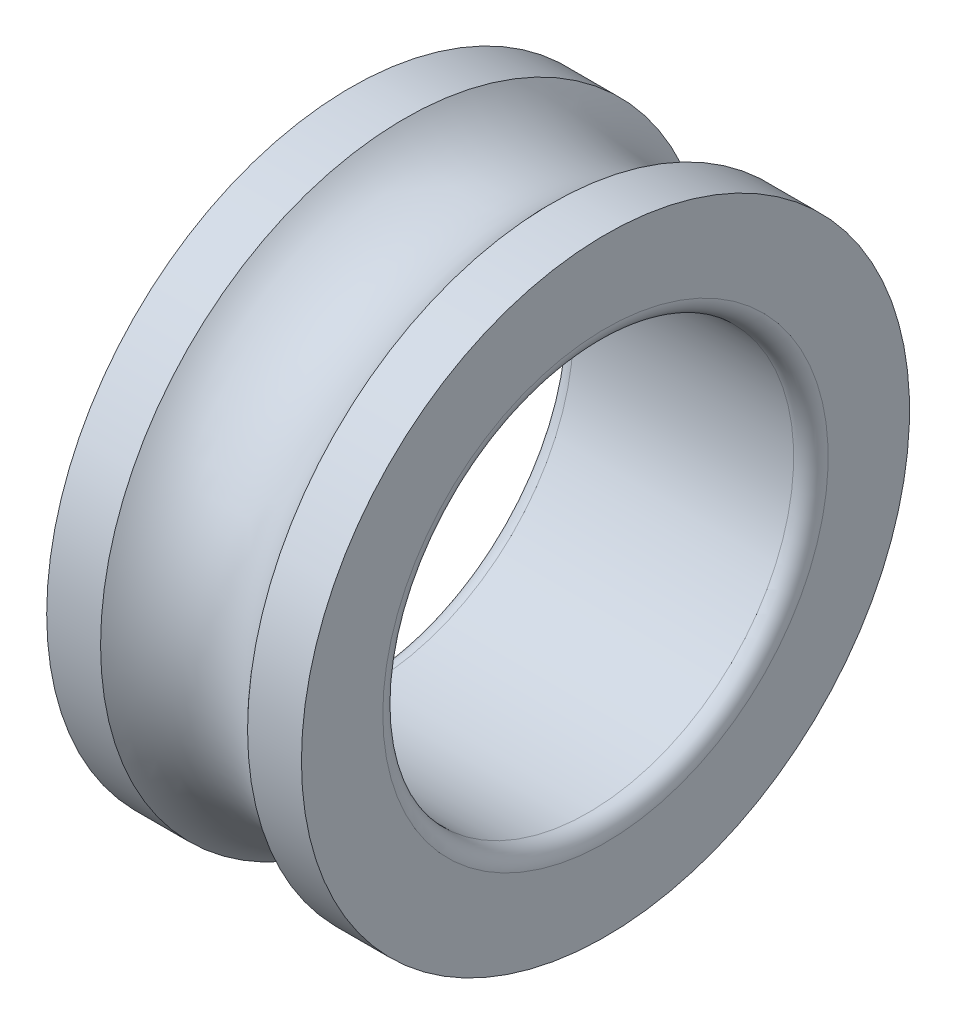
from build123d import *

# Parameters (mm, degrees)
SCALE1_SCALE = 0.168


with BuildPart() as part:
    # Sketch1 → Revolve1 (revolve)
    with BuildSketch(Plane.XY, mode=Mode.PRIVATE) as revolve1_sk:
        with BuildLine():
            Line((-19.243896498, 37), (-12.688168408, 37))
            ThreePointArc((-12.688168408, 37), (-3.743896498, 33), (5.200375412, 37))
            Line((5.200375412, 37), (11.756103502, 37))
            Line((11.756103502, 37), (11.756103502, 27.1))
            ThreePointArc((11.756103502, 27.1), (11.141027743, 25.61507576), (9.656103502, 25))
            Line((9.656103502, 25), (-17.143896498, 25))
            ThreePointArc((-17.143896498, 25), (-18.628820738, 25.61507576), (-19.243896498, 27.1))
            Line((-19.243896498, 27.1), (-19.243896498, 37))
        make_face()
    revolve(revolve1_sk.sketch.rotate(Axis((-29.974665728, 0, 0), (1, 0, 0)), 90), axis=Axis((-29.974665728, 0, 0), (1, 0, 0)))


with BuildPart() as part_1:
    # Scale1: scaled about (-3.743896498, 0, 0)
    add(part.part.scale(SCALE1_SCALE).moved(Location((-3.114921886, 0, 0))))


solid = part_1.part
